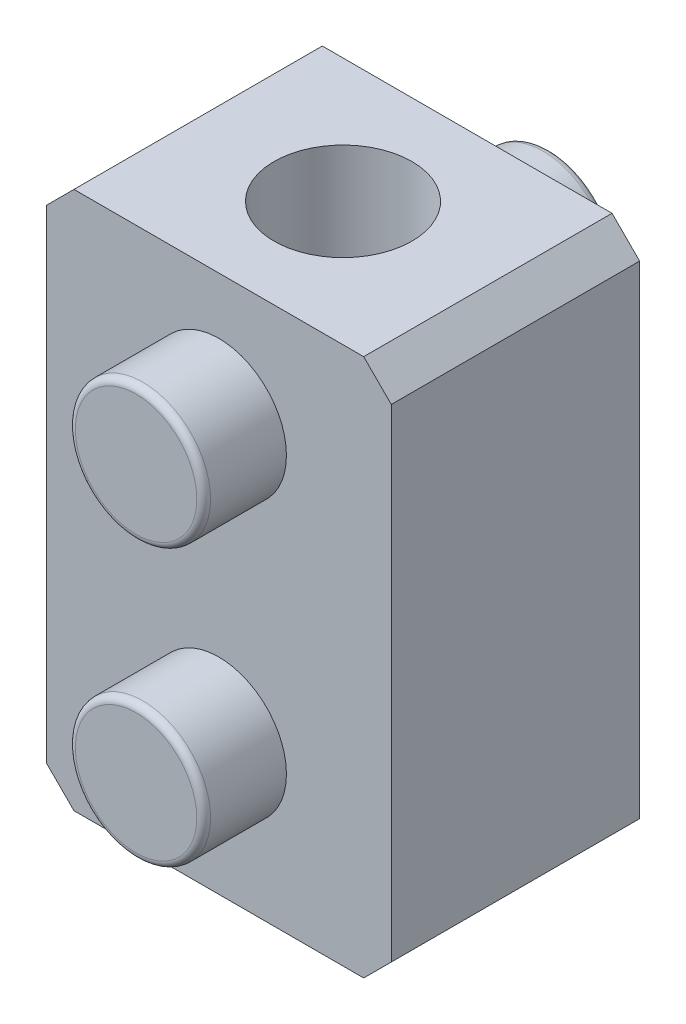
from build123d import *

# Parameters (mm, degrees)
SKETCH_1_W         = 12.5
SKETCH_1_H         = 19.5
EXTRUDE_1_DEPTH    = 9
SKETCH_2_R         = 2.45
EXTRUDE_2_DEPTH    = 3
EXTRUDE_START      = 3
SKETCH_4_R         = 2.45
EXTRUDE_3_DEPTH    = 3
FILLET_1_R         = 0.25
HOLE_WIZARD_M6_1_D = 5
CHAMFER_1_SIZE     = 1


with BuildPart() as part:
    # 스케치1 → 보스-돌출1 (new body)
    with BuildSketch(Plane.XY):
        Rectangle(SKETCH_1_W, SKETCH_1_H)
    extrude(amount=EXTRUDE_1_DEPTH)

    # 스케치2 → 보스-돌출2 (add)
    with BuildSketch(Plane.XY.offset(9)):
        with Locations((0, 5.25)):
            Circle(SKETCH_2_R)
        with Locations((0, -4.75)):
            Circle(SKETCH_2_R)
    extrude(amount=EXTRUDE_2_DEPTH)

    # 스케치4 → 보스-돌출3 (add)
    with BuildSketch(Plane(origin=(0, 0, 0), x_dir=(-1, 0, 0), z_dir=(0, 0, -1)).offset(EXTRUDE_START)):
        with Locations(Location((0, -4.75, 0), (0, 0, 180))):
            Circle(SKETCH_4_R)
        with Locations(Location((0, 5.25, 0), (0, 0, 180))):
            Circle(SKETCH_4_R)
    extrude(amount=-EXTRUDE_3_DEPTH)

    # 필렛1
    fillet_1_edges = [part.edges().sort_by_distance(p)[0] for p in [
        (-2.45, -4.75, 12),
        (-2.45, 5.25, 12),
        (-2.45, -4.75, -3),
        (-2.45, 5.25, -3),
    ]]
    fillet(fillet_1_edges, radius=FILLET_1_R)

    # M6 탭을 위한 탭 드릴1 (through all)
    with Locations(Plane(origin=(0, -9.75, 4.5), x_dir=(0, 0, -1), z_dir=(0, -1, 0))):
        with Locations((0, 0)):
            Hole(HOLE_WIZARD_M6_1_D / 2)

    # 모따기1
    chamfer_1_edges = [part.edges().sort_by_distance(p)[0] for p in [
        (6.25, -9.75, 4.5),
        (-6.25, -9.75, 4.5),
        (-6.25, 9.75, 4.5),
        (6.25, 9.75, 4.5),
    ]]
    chamfer(chamfer_1_edges, length=CHAMFER_1_SIZE)


solid = part.part
